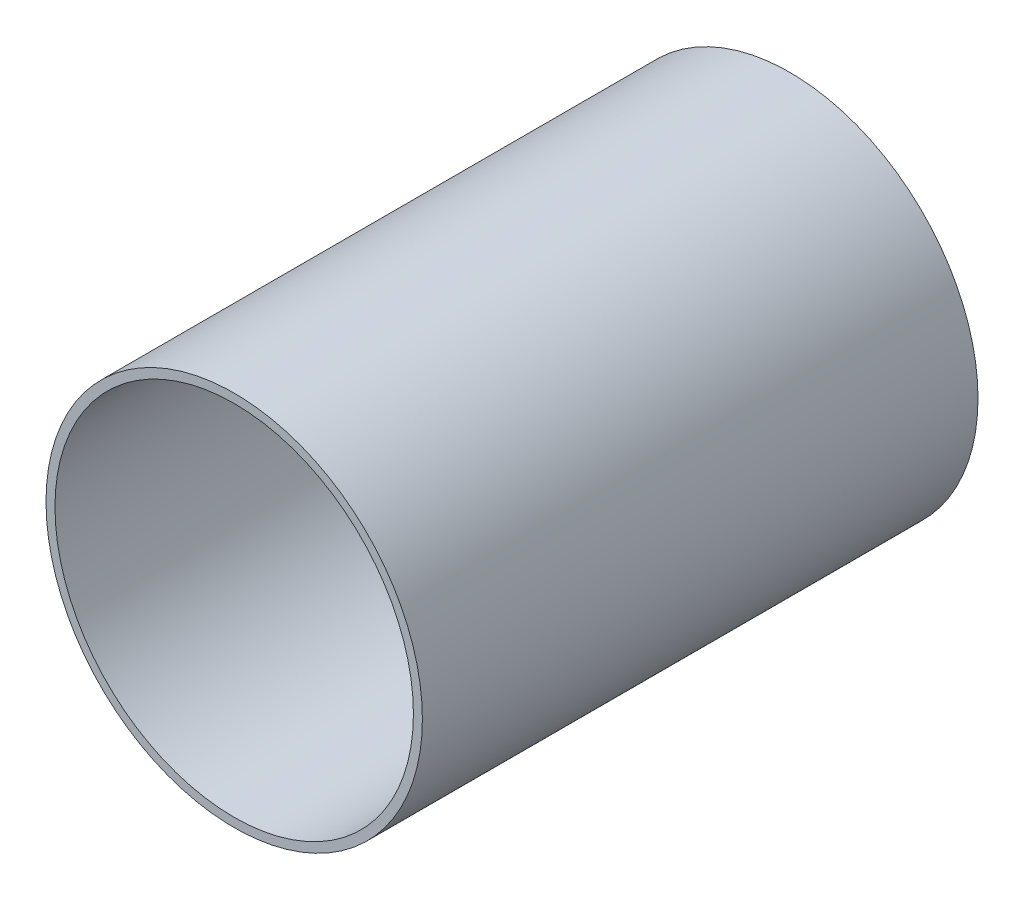
from build123d import *

# Parameters (mm, degrees)
SKETCH1_R           = 5.25
SKETCH1_R_2         = 5
BOSS_EXTRUDE1_DEPTH = 15.5


with BuildPart() as part:
    # Sketch1 → Boss-Extrude1 (new body)
    with BuildSketch(Plane.XY):
        Circle(SKETCH1_R)
        Circle(SKETCH1_R_2, mode=Mode.SUBTRACT)
    extrude(amount=BOSS_EXTRUDE1_DEPTH)


solid = part.part
